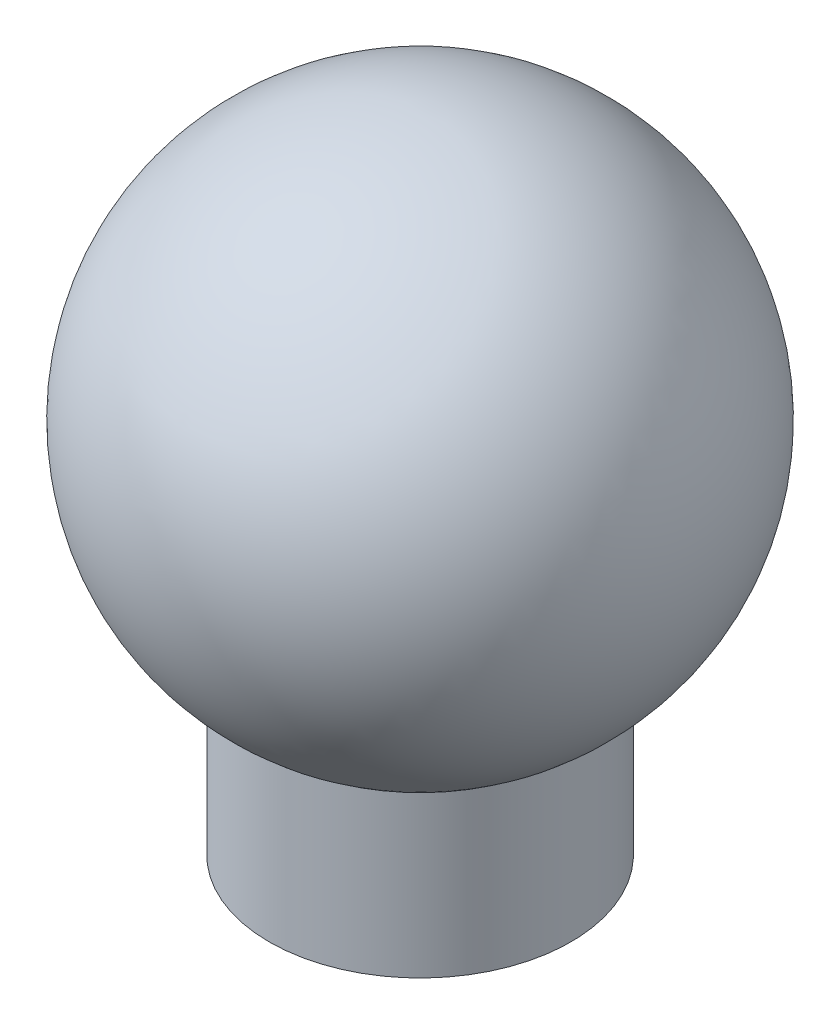
from build123d import *

# Parameters (mm, degrees)
SKETCH_1_R          = 4
EXTRUDE_1_DEPTH     = 10
CUT_EXTRUDE_1_DEPTH = 7


with BuildPart() as part:
    # 草图1 → 凸台-拉伸1 (new body)
    with BuildSketch(Plane(origin=(0, 0, 0), x_dir=(1, 0, 0), z_dir=(0, 1, 0))):
        with Locations(Location((0, 0, 0), (0, 0, 270))):
            Circle(SKETCH_1_R)
    extrude(amount=EXTRUDE_1_DEPTH)

    # 草图2 → 旋转1 (revolve)
    with BuildSketch(Plane(origin=(0, 10, 0), x_dir=(1, 0, 0), z_dir=(0, 1, 0))):
        with BuildLine():
            Line((0, 7), (0, -7))
            ThreePointArc((0, -7), (7, 0), (0, 7))
        make_face()
    revolve(axis=Axis((0, 10, -7), (0, 0, 1)))

    # 草图3 → 切除-拉伸1 (cut)
    with BuildSketch(Plane.XZ):
        with BuildLine():
            Line((0, 3.2), (-2.879179207, -1.396541118))
            ThreePointArc((-2.879179207, -1.396541118), (2.711911833, -1.698686025), (0, 3.2))
        make_face()
    extrude(amount=-CUT_EXTRUDE_1_DEPTH, mode=Mode.SUBTRACT)


solid = part.part
